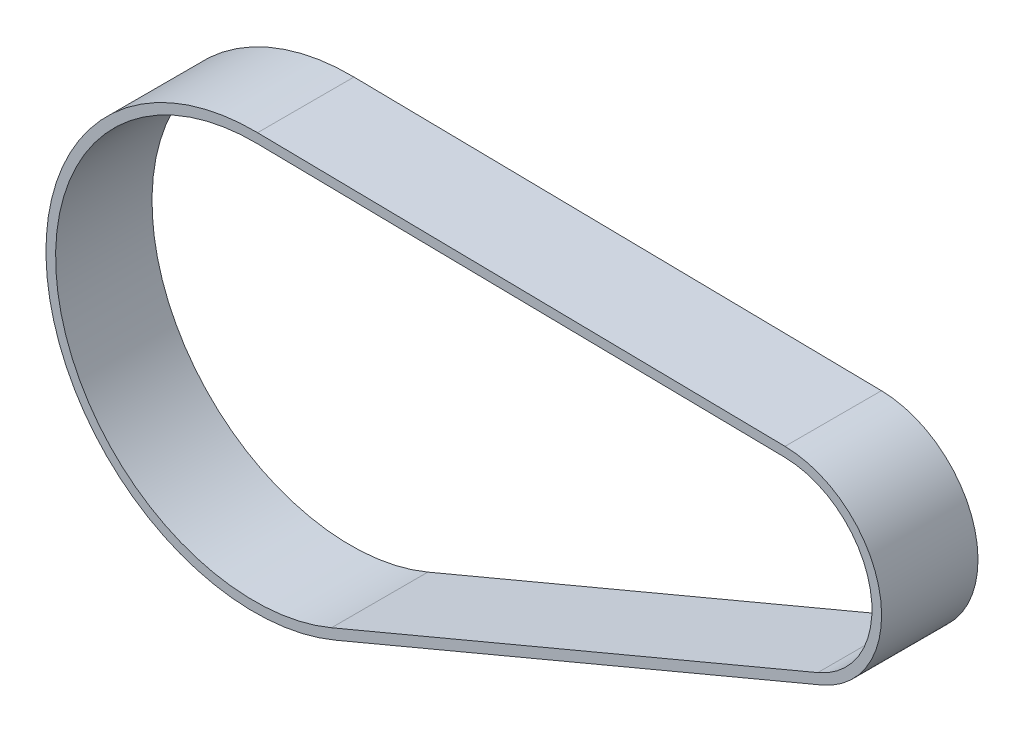
from build123d import *

# Parameters (mm, degrees)
BOSS_EXTRUDE1_DEPTH = 10


with BuildPart() as part:
    # Sketch1 → Boss-Extrude1 (new body)
    with BuildSketch(Plane.XY):
        with BuildLine():
            Line((-25.855001538, 77.83642818), (28.852575609, 77.015466766))
            ThreePointArc((28.852575609, 77.015466766), (38.684308439, 68.781049192), (32.639348603, 57.470564506))
            Line((32.639348603, 57.470564506), (-17.80298915, 36.277085862))
            ThreePointArc((-17.80298915, 36.277085862), (-47.40967832, 52.100567516), (-25.855001538, 77.83642818))
        make_face()
        with BuildLine():
            Line((-25.870006206, 76.836540756), (28.837570942, 76.015579343))
            ThreePointArc((28.837570942, 76.015579343), (37.702565047, 68.590839012), (32.251996542, 58.392496381))
            Line((32.251996542, 58.392496381), (-18.190341211, 37.199017736))
            ThreePointArc((-18.190341211, 37.199017736), (-46.427934928, 52.290777695), (-25.870006206, 76.836540756))
        make_face(mode=Mode.SUBTRACT)
    extrude(amount=BOSS_EXTRUDE1_DEPTH)


solid = part.part
